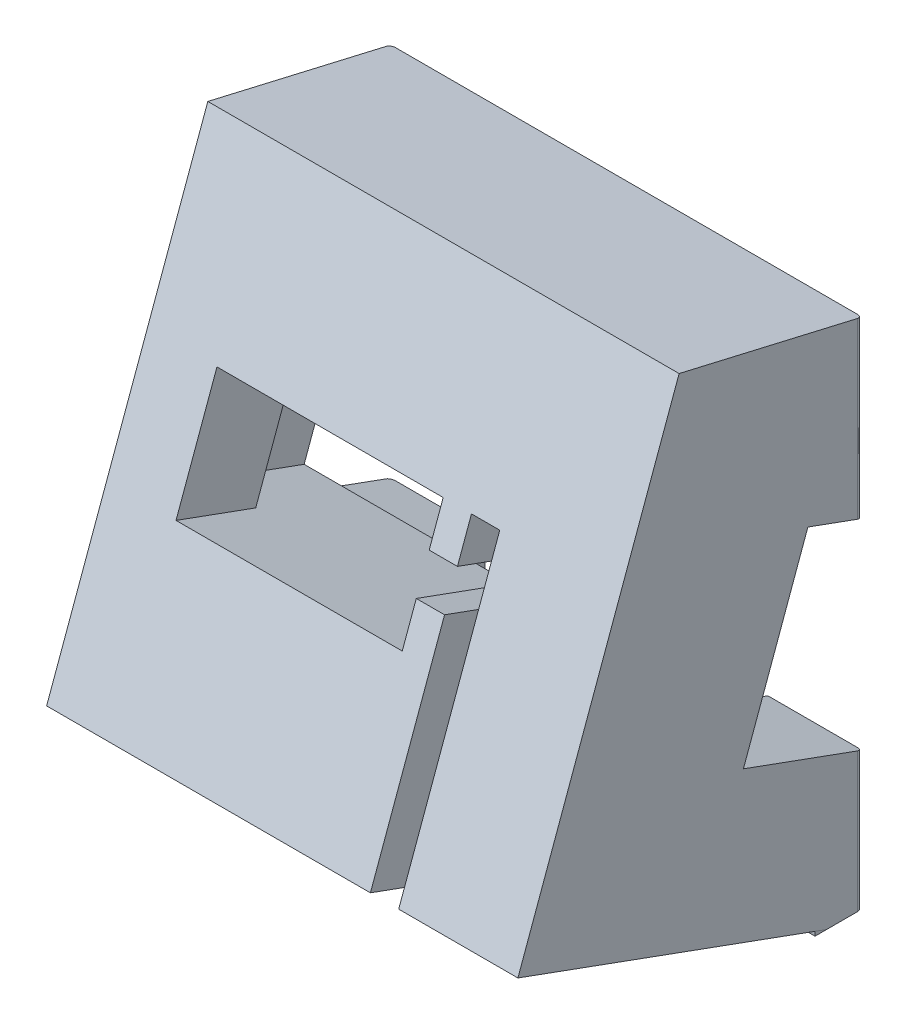
from build123d import *

# Parameters (mm, degrees)
SKETCH2_W            = 6
SKETCH2_H            = 6
BOSS_EXTRUDE1_DEPTH  = 5
SKETCH3_W            = 200
SKETCH3_H            = 20
CUT_EXTRUDE1_DEPTH   = 5
SKETCH4_W            = 5
SKETCH4_H            = 5
CUT_EXTRUDE2_DEPTH   = 5
SKETCH6_W            = 100
SKETCH6_H            = 20
BOSS_EXTRUDE2_DEPTH  = 100
BOSS_EXTRUDE3_DEPTH  = 100
CUT_EXTRUDE4_DEPTH   = 100
BOSS_EXTRUDE5_DEPTH  = 100
SKETCH14_R           = 12.5
CUT_EXTRUDE5_DEPTH   = 100
SKETCH15_R           = 15
SKETCH15_R_2         = 12.5
BOSS_EXTRUDE6_DEPTH  = 40
SKETCH16_W           = 50
SKETCH16_H           = 61.072294376
CUT_EXTRUDE10_DEPTH  = 35
SKETCH15_4_R         = 15
SKETCH15_4_R_2       = 12.5
CUT_EXTRUDE11_DEPTH  = 15
BOSS_EXTRUDE7_DEPTH  = 5
SKETCH23_R           = 15
SKETCH23_R_2         = 12.5
BOSS_EXTRUDE8_DEPTH  = 25
SKETCH21_W           = 50
SKETCH21_H           = 55
CUT_EXTRUDE12_DEPTH  = 35
SKETCH22_W           = 50
SKETCH22_H           = 55
BOSS_EXTRUDE9_DEPTH  = 5
SKETCH23_3_R         = 12.5
CUT_EXTRUDE13_DEPTH  = 20
CUT_EXTRUDE15_DEPTH  = 3
CUT_EXTRUDE16_DEPTH  = 5
SKETCH28_3_W         = 50
SKETCH28_3_H         = 5
BOSS_EXTRUDE12_DEPTH = 5
SKETCH31_W           = 50
SKETCH31_H           = 50
SKETCH31_W_2         = 24
SKETCH31_H_2         = 12.7
BOSS_EXTRUDE13_DEPTH = 20
SKETCH31_5_W         = 5.2
SKETCH31_5_H         = 12.7
CUT_EXTRUDE17_DEPTH  = 11
CUT_EXTRUDE18_DEPTH  = 9
SKETCH34_W           = 50
SKETCH34_H           = 50
CUT_EXTRUDE19_DEPTH  = 105
CUT_EXTRUDE20_DEPTH  = 110
SKETCH38_R           = 15
SKETCH38_R_2         = 12.5
CUT_EXTRUDE21_DEPTH  = 20
SKETCH39_W           = 3
SKETCH39_H           = 31.35
CUT_EXTRUDE23_DEPTH  = 20
BOSS_EXTRUDE15_DEPTH = 50
SKETCH42_W           = 30
SKETCH42_H           = 18.394120173
CUT_EXTRUDE24_DEPTH  = 55
CUT_EXTRUDE25_DEPTH  = 55
FILLET1_R            = 0.5
BOSS_EXTRUDE16_DEPTH = 10
BOSS_EXTRUDE17_DEPTH = 10


with BuildPart() as part:
    # Sketch2 → Boss-Extrude1 (new body)
    with BuildSketch(Plane.XY):
        Polygon((-100, 75), (-100, -45), (-60, -45), (-60, -65), (0, -65), (60, -65), (60, -45), (100, -45), (100, 75), align=None)
        with Locations((55, -50)):
            Rectangle(SKETCH2_W, SKETCH2_H, mode=Mode.SUBTRACT)
        with Locations((-55, -50)):
            Rectangle(SKETCH2_W, SKETCH2_H, mode=Mode.SUBTRACT)
    extrude(amount=BOSS_EXTRUDE1_DEPTH)

    # Sketch3 → Cut-Extrude1 (cut)
    with BuildSketch(Plane.XY.offset(5)):
        with Locations((0, 65)):
            Rectangle(SKETCH3_W, SKETCH3_H)
    extrude(amount=-CUT_EXTRUDE1_DEPTH, mode=Mode.SUBTRACT)

    # Sketch4 → Cut-Extrude2 (cut)
    with BuildSketch(Plane(origin=(0, 0, 0), x_dir=(-1, 0, 0), z_dir=(0, 0, -1))):
        with Locations((-97.5, 47.5)):
            Rectangle(SKETCH4_W, SKETCH4_H)
        Polygon((95, 50), (95, 45), (97.5, 45), (100, 45), (100, 50), align=None)
        with Locations((-97.5, 5)):
            Rectangle(SKETCH4_W, SKETCH4_H)
        with Locations((97.5, 5)):
            Rectangle(SKETCH4_W, SKETCH4_H)
        with Locations((-97.5, -37.5)):
            Rectangle(SKETCH4_W, SKETCH4_H)
        Polygon((100, -35), (95, -35), (95, -40), (97.5, -40), (100, -40), align=None)
    extrude(amount=-CUT_EXTRUDE2_DEPTH, mode=Mode.SUBTRACT)

    # Sketch6 → Boss-Extrude2 (add)
    with BuildSketch(Plane(origin=(0, 0, 0), x_dir=(-1, 0, 0), z_dir=(0, 0, -1))):
        with Locations((0, -55)):
            Rectangle(SKETCH6_W, SKETCH6_H)
    extrude(amount=BOSS_EXTRUDE2_DEPTH)

    # Sketch8 → Boss-Extrude3 (add)
    with BuildSketch(Plane(origin=(50, 0, 0), x_dir=(0, 0, -1), z_dir=(1, 0, 0))):
        Polygon((42.17911114, -45), (100, -45), (100, 55), (78.57613456, 55), (63.797824283, 14.396926208), (60.37762285, 5), (56.957421417, -4.396926208), align=None)
    extrude(amount=-BOSS_EXTRUDE3_DEPTH)

    # Sketch12 → Cut-Extrude4 (cut)
    with BuildSketch(Plane(origin=(50, 0, 0), x_dir=(0, 0, -1), z_dir=(1, 0, 0))):
        Polygon((78.57613456, 55), (42.17911114, -45), (47.5, -45), (83.89702342, 55), align=None)
    extrude(amount=-CUT_EXTRUDE4_DEPTH, mode=Mode.SUBTRACT)

    # Sketch13 → Boss-Extrude5 (add)
    with BuildSketch(Plane(origin=(0, -20.530205756, -56.406276742), x_dir=(1, 0, 0), z_dir=(0, 0.3420201432707361, 0.9396926208059023))):
        with BuildLine():
            ThreePointArc((10, 27.168677492), (7.071067812, 34.239745304), (0, 37.168677492))
            ThreePointArc((0, 37.168677492), (-7.071067812, 20.09760968), (10, 27.168677492))
        make_face()
    extrude(amount=BOSS_EXTRUDE5_DEPTH)

    # Sketch14 → Cut-Extrude5 (cut)
    with BuildSketch(Plane(origin=(0, 13.671808571, 37.562985339), x_dir=(1, 0, 0), z_dir=(0, 0.34202014327073604, 0.9396926208059022))):
        with Locations((0, 27.168677492)):
            Circle(SKETCH14_R)
    extrude(amount=-CUT_EXTRUDE5_DEPTH, mode=Mode.SUBTRACT)

    # Sketch15 → Boss-Extrude6 (add)
    with BuildSketch(Plane(origin=(0, 13.671808571, 37.562985339), x_dir=(1, 0, 0), z_dir=(0, 0.3420201432707362, 0.9396926208059023))):
        with Locations((0, 27.168677492)):
            Circle(SKETCH15_R)
        with Locations((0, 27.168677492)):
            Circle(SKETCH15_R_2, mode=Mode.SUBTRACT)
    extrude(amount=-BOSS_EXTRUDE6_DEPTH)

    # Sketch16 → Cut-Extrude10 (cut)
    with BuildSketch(Plane(origin=(0, 0, -30), x_dir=(-1, 0, 0), z_dir=(0, 0, -1))):
        with Locations((0, 30.536147188)):
            Rectangle(SKETCH16_W, SKETCH16_H)
    extrude(amount=-CUT_EXTRUDE10_DEPTH, mode=Mode.SUBTRACT)


with BuildPart() as cut_extrude10_piece_1:
    # of the separate pieces the step leaves, piece 1, a body of its own (cut_extrude10_pieces)
    add(part.part.solids().sort_by_distance((-100, 55, 0))[0])

    # Sketch18 → Boss-Extrude7 (add)
    with BuildSketch(Plane.XY.offset(5)):
        Polygon((30, 55), (25, 55), (25, 0), (-25, 0), (-25, 55), (-30, 55), (-30, -5), (30, -5), (30, 0), align=None)
    extrude(amount=BOSS_EXTRUDE7_DEPTH)



with BuildPart() as cut_extrude10_piece_2:
    # of the separate pieces the step leaves, piece 2, a body of its own (cut_extrude10_pieces)
    add(part.part.solids().sort_by_distance((15, 39.202014327, 28.270750371))[0])

    # Sketch15<4> → Cut-Extrude11 (cut)
    with BuildSketch(Plane(origin=(0, 13.671808571, 37.562985339), x_dir=(1, 0, 0), z_dir=(0, 0.3420201432707362, 0.9396926208059023))):
        with Locations((0, 27.168677492)):
            Circle(SKETCH15_4_R)
        with Locations((0, 27.168677492)):
            Circle(SKETCH15_4_R_2, mode=Mode.SUBTRACT)
    extrude(amount=-CUT_EXTRUDE11_DEPTH, mode=Mode.SUBTRACT)

    # Sketch23 → Boss-Extrude8 (add)
    with BuildSketch(Plane(origin=(0, 8.541506422, 23.467596027), x_dir=(1, 0, 0), z_dir=(0, 0.34202014327073627, 0.9396926208059023))):
        with Locations((0, 27.168677492)):
            Circle(SKETCH23_R)
        with Locations((0, 27.168677492)):
            Circle(SKETCH23_R_2, mode=Mode.SUBTRACT)
    extrude(amount=-BOSS_EXTRUDE8_DEPTH)

    # Sketch21 → Cut-Extrude12 (cut)
    with BuildSketch(Plane(origin=(0, 0, -30), x_dir=(-1, 0, 0), z_dir=(0, 0, -1))):
        with Locations((0, 27.5)):
            Rectangle(SKETCH21_W, SKETCH21_H)
    extrude(amount=-CUT_EXTRUDE12_DEPTH, mode=Mode.SUBTRACT)


with BuildPart() as cut_extrude10_piece_1_1:
    add(cut_extrude10_piece_1.part)

    add(cut_extrude10_piece_2.part)  # Boss-Extrude9 merges Cut-Extrude10 piece 2
    # Sketch22 → Boss-Extrude9 (add)
    with BuildSketch(Plane(origin=(0, 0, 0), x_dir=(-1, 0, 0), z_dir=(0, 0, -1))):
        with Locations((0, 27.5)):
            Rectangle(SKETCH22_W, SKETCH22_H)
    extrude(amount=-BOSS_EXTRUDE9_DEPTH)

    # Sketch23<3> → Cut-Extrude13 (cut)
    with BuildSketch(Plane(origin=(0, 8.541506422, 23.467596027), x_dir=(1, 0, 0), z_dir=(0, 0.34202014327073627, 0.9396926208059023))):
        with Locations((0, 27.168677492)):
            Circle(SKETCH23_3_R)
    extrude(amount=-CUT_EXTRUDE13_DEPTH, mode=Mode.SUBTRACT)

    # Sketch27 → Cut-Extrude15 (cut)
    with BuildSketch(Plane(origin=(0, 8.541506422, 23.467596027), x_dir=(1, 0, 0), z_dir=(0, 0.34202014327073627, 0.9396926208059023))):
        with BuildLine():
            ThreePointArc((2, 42.034746239), (0, 42.168677492), (-2, 42.034746239))
            Line((-2, 42.034746239), (-2, 39.507640171))
            ThreePointArc((-2, 39.507640171), (0, 39.668677492), (2, 39.507640171))
            Line((2, 39.507640171), (2, 42.034746239))
        make_face()
        with BuildLine():
            Line((-12.338962679, 29.168677492), (-14.866068747, 29.168677492))
            ThreePointArc((-14.866068747, 29.168677492), (-15, 27.168677492), (-14.866068747, 25.168677492))
            Line((-14.866068747, 25.168677492), (-12.338962679, 25.168677492))
            ThreePointArc((-12.338962679, 25.168677492), (-12.5, 27.168677492), (-12.338962679, 29.168677492))
        make_face()
        with BuildLine():
            ThreePointArc((14.866068747, 25.168677492), (15, 27.168677492), (14.866068747, 29.168677492))
            Line((14.866068747, 29.168677492), (12.338962679, 29.168677492))
            ThreePointArc((12.338962679, 29.168677492), (12.5, 27.168677492), (12.338962679, 25.168677492))
            Line((12.338962679, 25.168677492), (14.866068747, 25.168677492))
        make_face()
        with BuildLine():
            ThreePointArc((2, 14.829714813), (0, 14.668677492), (-2, 14.829714813))
            Line((-2, 14.829714813), (-2, 12.302608744))
            ThreePointArc((-2, 12.302608744), (0, 12.168677492), (2, 12.302608744))
            Line((2, 12.302608744), (2, 14.829714813))
        make_face()
    extrude(amount=-CUT_EXTRUDE15_DEPTH, mode=Mode.SUBTRACT)

    # Sketch28 → Cut-Extrude16 (cut)
    with BuildSketch(Plane.XY.offset(10)):
        Polygon((25, 0), (-25, 0), (-30, 0), (-30, -5), (30, -5), (30, 0), align=None)
    extrude(amount=-CUT_EXTRUDE16_DEPTH, mode=Mode.SUBTRACT)

    # Sketch28<3> → Boss-Extrude12 (add)
    with BuildSketch(Plane.XY.offset(10)):
        with Locations((0, 2.5)):
            Rectangle(SKETCH28_3_W, SKETCH28_3_H)
    extrude(amount=-BOSS_EXTRUDE12_DEPTH)

    # Sketch31 → Boss-Extrude13 (add)
    with BuildSketch(Plane(origin=(0, 8.541506422, 23.467596027), x_dir=(1, 0, 0), z_dir=(0, 0.34202014327073627, 0.9396926208059023))):
        with Locations((0, 27.168677492)):
            Rectangle(SKETCH31_W, SKETCH31_H)
        with Locations((-5.65, 27.168677492)):
            Rectangle(SKETCH31_W_2, SKETCH31_H_2, mode=Mode.SUBTRACT)
    extrude(amount=BOSS_EXTRUDE13_DEPTH)

    # Sketch31<5> → Cut-Extrude17 (cut)
    with BuildSketch(Plane(origin=(0, 8.541506422, 23.467596027), x_dir=(1, 0, 0), z_dir=(0, 0.34202014327073627, 0.9396926208059023))):
        with Locations((8.95, 27.168677492)):
            Rectangle(SKETCH31_5_W, SKETCH31_5_H)
        with Locations((-20.25, 27.168677492)):
            Rectangle(SKETCH31_5_W, SKETCH31_5_H)
    extrude(amount=CUT_EXTRUDE17_DEPTH, mode=Mode.SUBTRACT)

    # Sketch32 → Cut-Extrude18 (cut)
    with BuildSketch(Plane(origin=(0, 15.381909287, 42.261448443), x_dir=(1, 0, 0), z_dir=(0, 0.3420201432707363, 0.9396926208059021))):
        Polygon((9.35, 29.168677492), (6.35, 29.168677492), (6.35, 27.168677492), (6.35, 25.168677492), (9.35, 25.168677492), align=None)
    extrude(amount=-CUT_EXTRUDE18_DEPTH, mode=Mode.SUBTRACT)

    # Sketch34 → Cut-Extrude19 (cut)
    with BuildSketch(Plane(origin=(0, 0, -100), x_dir=(-1, 0, 0), z_dir=(0, 0, -1))):
        Polygon((-100, 55), (-100, -65), (100, -65), (100, 55), (30, 55), (30, 0), (-30, 0), (-30, 55), align=None)
        with Locations((0, 30)):
            Rectangle(SKETCH34_W, SKETCH34_H)
    extrude(amount=-CUT_EXTRUDE19_DEPTH, mode=Mode.SUBTRACT)


with BuildPart() as cut_extrude19_piece_1:
    # of the separate pieces the step leaves, piece 1, a body of its own (cut_extrude19_pieces)
    add(cut_extrude10_piece_1_1.part.solids().sort_by_distance((-30, 55, 0))[0])


with BuildPart() as cut_extrude19_piece_2:
    # of the separate pieces the step leaves, piece 2, a body of its own (cut_extrude19_pieces)
    add(cut_extrude10_piece_1_1.part.solids().sort_by_distance((30, 55, -100))[0])


with BuildPart() as cut_extrude20_tool:
    # Sketch34<3> → Cut-Extrude20 (new body)
    with BuildSketch(Plane(origin=(0, 0, -100), x_dir=(-1, 0, 0), z_dir=(0, 0, -1))):
        Polygon((-25, 55), (-30, 55), (-30, 0), (30, 0), (30, 55), (25, 55), (25, 5), (-25, 5), align=None)
    extrude(amount=-CUT_EXTRUDE20_DEPTH)


with BuildPart() as cut_extrude19_piece_1_1:
    add(cut_extrude19_piece_1.part)

    # Cut-Extrude20: cut by cut_extrude20_tool
    add(cut_extrude20_tool.part, mode=Mode.SUBTRACT)

    # Sketch38 → Cut-Extrude21 (cut)
    with BuildSketch(Plane(origin=(0, 1.701103557, 4.673743611), x_dir=(-1, 0, 0), z_dir=(0, -0.3420201432707364, -0.9396926208059022))):
        with Locations((0, 27.168677492)):
            Circle(SKETCH38_R)
        with Locations((0, 27.168677492)):
            Circle(SKETCH38_R_2, mode=Mode.SUBTRACT)
    extrude(amount=-CUT_EXTRUDE21_DEPTH, mode=Mode.SUBTRACT)

    # Sketch39 → Cut-Extrude23 (cut)
    with BuildSketch(Plane(origin=(0, 15.381909287, 42.261448443), x_dir=(1, 0, 0), z_dir=(0, 0.3420201432707363, 0.9396926208059021))):
        with Locations((10.85, 17.843677492)):
            Rectangle(SKETCH39_W, SKETCH39_H)
    extrude(amount=-CUT_EXTRUDE23_DEPTH, mode=Mode.SUBTRACT)

    # Sketch36 → Boss-Extrude15 (add)
    with BuildSketch(Plane(origin=(25, 0, 0), x_dir=(0, 0, -1), z_dir=(1, 0, 0))):
        Polygon((5, 57.564027698), (-24.418709893, 64.404430564), (-5.624857477, 57.564027698), (-10.755159626, 43.468638386), (-5, 41.373931589), (-5, 55), (0, 55), (0, 45), (5, 45), align=None)
        Polygon((-17.595562491, 24.67478597), (-22.72586464, 10.579396658), (-8.770337016, 5.5), (-5, 5.5), (-5, 20.09037614), align=None)
    extrude(amount=-BOSS_EXTRUDE15_DEPTH)

    # Sketch42 → Cut-Extrude24 (cut)
    with BuildSketch(Plane(origin=(0, 2.037890236, -0.741731386), x_dir=(1, 0, 0), z_dir=(0, -0.9396926208059022, 0.3420201432707364))):
        with Locations((0, 15.776633978)):
            Rectangle(SKETCH42_W, SKETCH42_H)
    extrude(amount=-CUT_EXTRUDE24_DEPTH, mode=Mode.SUBTRACT)

    # Sketch43 → Cut-Extrude25 (cut)
    with BuildSketch(Plane.ZY.offset(25)):
        Polygon((5, 55), (5, 64.404430564), (-5, 64.404430564), (-5, 45), (5, 45), align=None)
    extrude(amount=-CUT_EXTRUDE25_DEPTH, mode=Mode.SUBTRACT)

    # Fillet1
    fillet1_edges = [cut_extrude19_piece_1_1.edges().sort_by_distance(p)[0] for p in [
        (-25, 50.6315736, 5),
        (-25, 12.79518807, 5),
        (25, 12.79518807, 5),
        (25, 50.6315736, 5),
    ]]
    fillet(fillet1_edges, radius=FILLET1_R)

    # Sketch45 → Boss-Extrude16 (add)
    with BuildSketch(Plane.ZY.offset(25)):
        Polygon((10, 5.947560724), (8.770337016, 5.5), (10, 5.5), align=None)
    extrude(amount=-BOSS_EXTRUDE16_DEPTH)


with BuildPart() as cut_extrude19_piece_2_1:
    add(cut_extrude19_piece_2.part)

    # Cut-Extrude20: cut by cut_extrude20_tool
    add(cut_extrude20_tool.part, mode=Mode.SUBTRACT)


with BuildPart() as body_2:
    # Sketch46 → Boss-Extrude17 (new body)
    with BuildSketch(Plane(origin=(25, 0, 0), x_dir=(0, 0, -1), z_dir=(1, 0, 0))):
        Polygon((-10, 5.5), (-8.770337016, 5.5), (-10, 5.947560724), align=None)
    extrude(amount=-BOSS_EXTRUDE17_DEPTH)


solid = Compound([cut_extrude19_piece_1_1.part, body_2.part])
